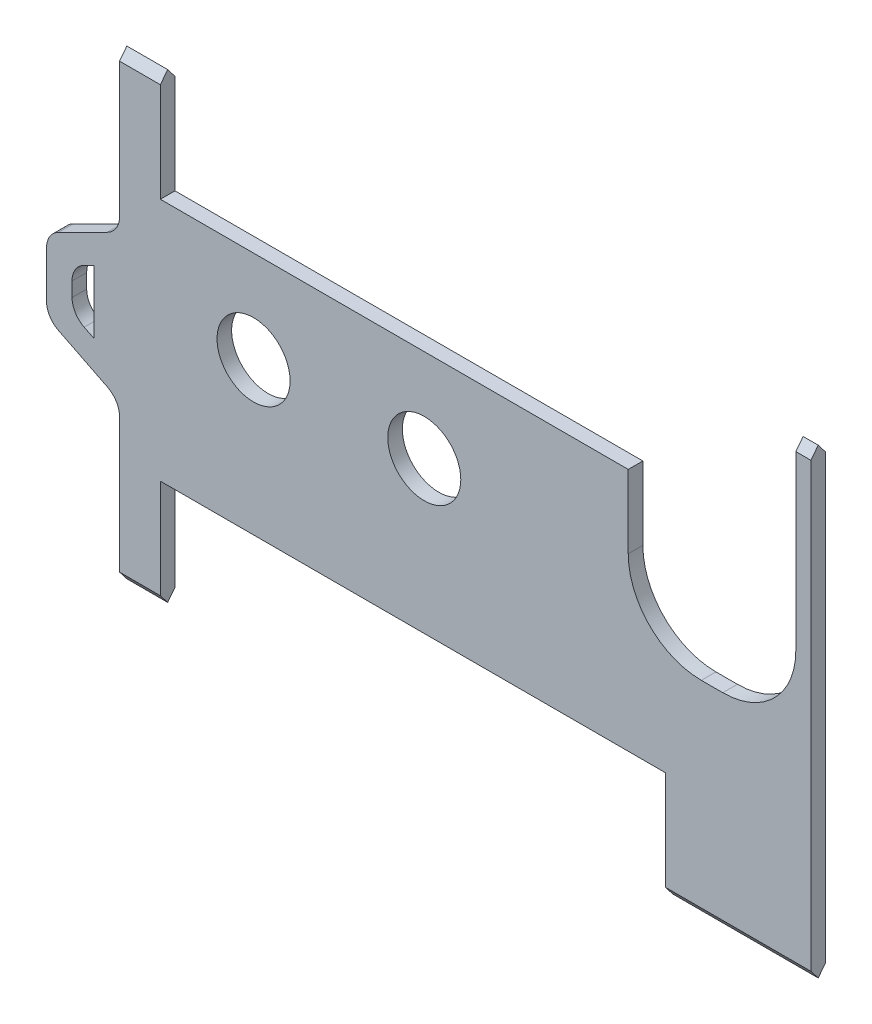
from build123d import *

# Parameters (mm, degrees)
SKETCH1_R           = 5
BOSS_EXTRUDE1_DEPTH = 1
CUT_EXTRUDE1_DEPTH  = 161.089628267
FILLET1_R           = 10
FILLET2_R           = 3


with BuildPart() as part:
    # Sketch1 → Boss-Extrude1 (new, symmetric)
    with BuildSketch(Plane.XY.offset(11.1483132)):
        Polygon((12.416678302, 91.852215255), (22.416678302, 86.852215255), (22.416678302, 65.146170087), (28.004353293, 65.146170087), (28.004353293, 80.146170087), (97.122940581, 80.146170087), (97.122940581, 65.146170087), (117.041628722, 65.146170087), (117.041628722, 128.558260423), (114.975774521, 128.558260423), (114.975774521, 93.558260423), (92.041628722, 93.558260423), (92.041628722, 113.558260423), (28.004353293, 113.558260423), (28.004353293, 128.558260423), (22.416678302, 128.558260423), (22.416678302, 106.852215255), (12.416678302, 101.852215255), align=None)
        Polygon((18.916678302, 92.515334216), (15.916678302, 94.015334216), (15.916678302, 99.689096294), (18.916678302, 101.189096294), align=None, mode=Mode.SUBTRACT)
        with Locations((64.122810805, 100.881519454)):
            Circle(SKETCH1_R, mode=Mode.SUBTRACT)
        with Locations((40.75880907, 100.906977446)):
            Circle(SKETCH1_R, mode=Mode.SUBTRACT)
    extrude(amount=BOSS_EXTRUDE1_DEPTH, both=True)

    # Sketch2 → Cut-Extrude1 (cut, through all)
    with BuildSketch(Plane.ZY.offset(-22.416678302)):
        Polygon((10.106589297, 128.558260423), (10.106589297, 127.082553075), (11.1483132, 128.431101618), (12.190037103, 127.082553075), (12.190037103, 128.558260423), align=None)
        Polygon((12.190037103, 66.621877435), (12.190037103, 65.146170087), (10.106589297, 65.146170087), (10.106589297, 66.621877435), (11.1483132, 65.273328892), align=None)
    extrude(amount=-CUT_EXTRUDE1_DEPTH, mode=Mode.SUBTRACT)

    # Fillet1
    fillet1_edges = [part.edges().sort_by_distance(p)[0] for p in [
        (92.041628722, 93.558260423, 11.1483132),
        (114.975774521, 93.558260423, 11.1483132),
    ]]
    fillet(fillet1_edges, radius=FILLET1_R)

    # Fillet2
    fillet2_edges = [part.edges().sort_by_distance(p)[0] for p in [
        (15.916678302, 94.015334216, 11.1483132),
        (15.916678302, 99.689096294, 11.1483132),
        (22.416678302, 86.852215255, 11.1483132),
        (12.416678302, 91.852215255, 11.1483132),
        (12.416678302, 101.852215255, 11.1483132),
        (22.416678302, 106.852215255, 11.1483132),
    ]]
    fillet(fillet2_edges, radius=FILLET2_R)


solid = part.part
